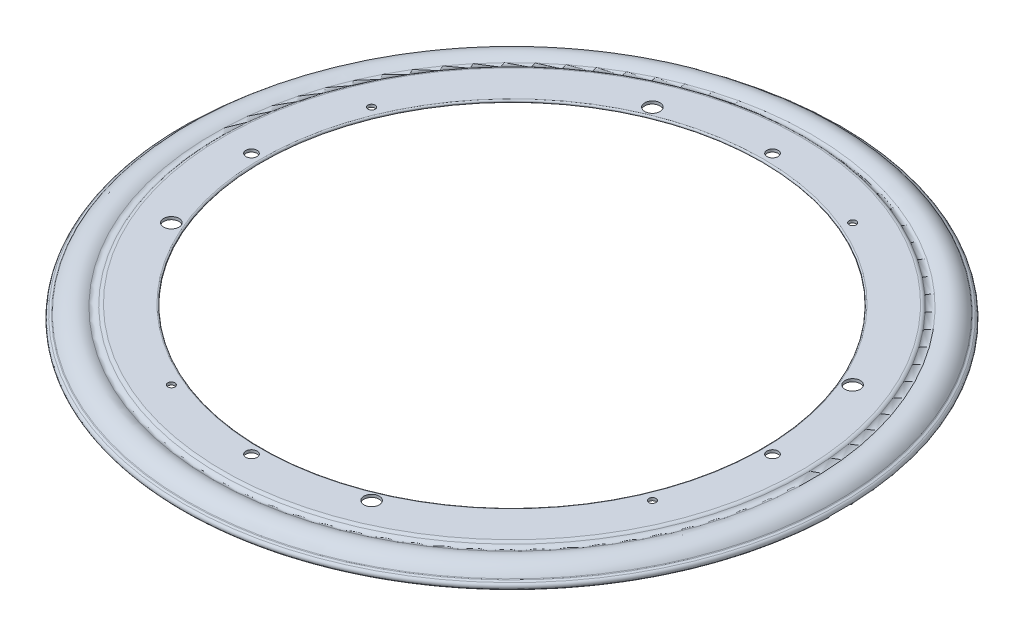
from build123d import *

# Parameters (mm, degrees)
SKETCH2_R          = 1.651
SKETCH2_R_2        = 2.54
SKETCH2_R_3        = 3.4925
CUT_EXTRUDE1_DEPTH = 1.27


with BuildPart() as part:
    # Sketch1 → Revolve1 (revolve)
    with BuildSketch(Plane(origin=(0, 0, 0), x_dir=(0, 0, -1), z_dir=(1, 0, 0)), mode=Mode.PRIVATE) as revolve1_sk:
        with BuildLine():
            Line((-121.793, 8.89), (-116.713, 8.89))
            Line((-116.713, 8.89), (-114.935, 8.89))
            ThreePointArc((-114.935, 8.89), (-114.3, 8.255), (-114.935, 7.62))
            Line((-114.935, 7.62), (-116.713, 7.62))
            Line((-116.713, 7.62), (-121.793, 7.62))
            Line((-121.793, 7.62), (-133.35, 7.62))
            ThreePointArc((-133.35, 7.62), (-135.195021074, 6.382567639), (-137.386054728, 6.749600521))
            ThreePointArc((-137.386054728, 6.749600521), (-142.360024973, 7.839867424), (-146.964119908, 5.664695766))
            ThreePointArc((-146.964119908, 5.664695766), (-147.695093611, 4.53646091), (-147.859954479, 3.202273016))
            ThreePointArc((-147.859954479, 3.202273016), (-150.098460128, 1.746924569), (-149.971866034, 4.413930489))
            Line((-149.971866034, 4.413930489), (-149.063833849, 4.826))
            ThreePointArc((-149.063833849, 4.826), (-148.905232286, 4.925590493), (-148.778854651, 5.063798364))
            ThreePointArc((-148.778854651, 5.063798364), (-143.37276498, 8.684423584), (-136.948504859, 7.653106752))
            ThreePointArc((-136.948504859, 7.653106752), (-135.263052634, 7.339686916), (-133.771985429, 8.185677335))
            ThreePointArc((-133.771985429, 8.185677335), (-133.087669633, 8.705400048), (-132.248430296, 8.89))
            Line((-132.248430296, 8.89), (-121.793, 8.89))
        make_face()
    revolve(revolve1_sk.sketch.rotate(Axis((0, 0, 0), (0, 1, 0)), 180), axis=Axis((0, 0, 0), (0, 1, 0)))

    # Sketch2 → Cut-Extrude1 (cut)
    with BuildSketch(Plane(origin=(0, 8.89, 0), x_dir=(1, 0, 0), z_dir=(0, 1, 0))):
        with Locations(Location((-45.828370113, -110.095588021, 0), (0, 0, 270))):
            Circle(SKETCH2_R)
        with Locations(Location((0, -119.253, 0), (0, 0, 270))):
            Circle(SKETCH2_R_2)
        with Locations(Location((45.828370113, -110.095588021, 0), (0, 0, 270))):
            Circle(SKETCH2_R_3)
        with Locations(Location((110.095588021, -45.828370113, 0), (0, 0, 270))):
            Circle(SKETCH2_R)
        with Locations(Location((119.253, 0, 0), (0, 0, 270))):
            Circle(SKETCH2_R_2)
        with Locations(Location((110.095588021, 45.828370113, 0), (0, 0, 270))):
            Circle(SKETCH2_R_3)
        with Locations(Location((45.828370113, 110.095588021, 0), (0, 0, 270))):
            Circle(SKETCH2_R)
        with Locations(Location((-110.095588021, -45.828370113, 0), (0, 0, 270))):
            Circle(SKETCH2_R_3)
        with Locations(Location((-119.253, 0, 0), (0, 0, 270))):
            Circle(SKETCH2_R_2)
        with Locations(Location((-110.095588021, 45.828370113, 0), (0, 0, 270))):
            Circle(SKETCH2_R)
        with Locations(Location((0, 119.253, 0), (0, 0, 270))):
            Circle(SKETCH2_R_2)
        with Locations(Location((-45.828370113, 110.095588021, 0), (0, 0, 270))):
            Circle(SKETCH2_R_3)
    extrude(amount=-CUT_EXTRUDE1_DEPTH, mode=Mode.SUBTRACT)


solid = part.part
